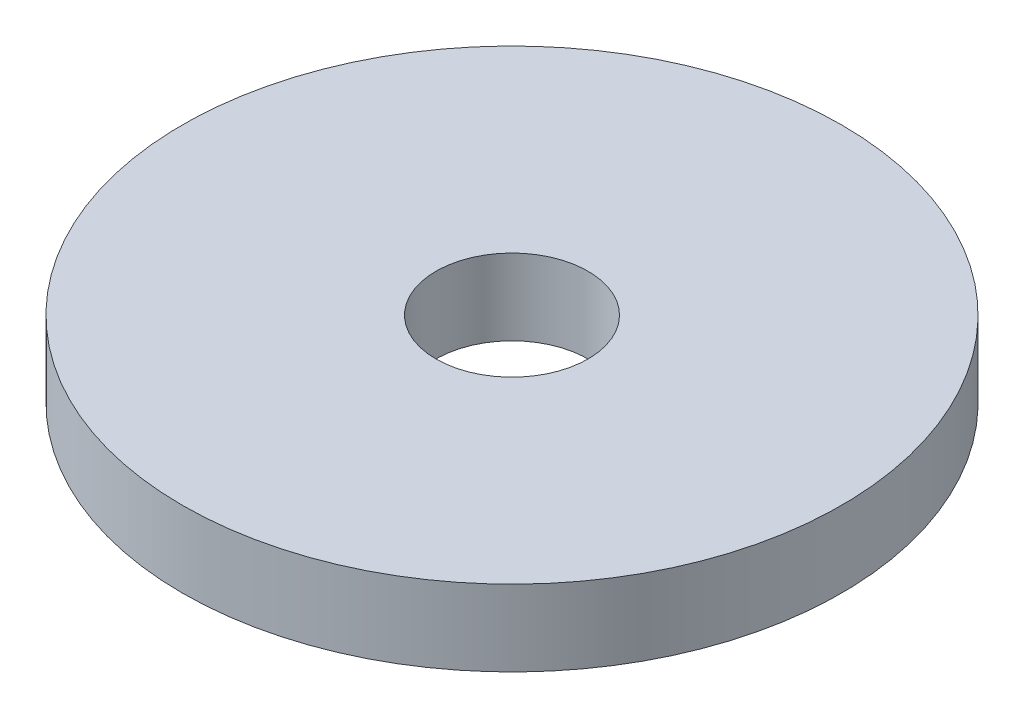
from build123d import *

# Parameters (mm, degrees)
SKETCH1_R           = 13
SKETCH1_R_2         = 3
BOSS_EXTRUDE1_DEPTH = 3


with BuildPart() as part:
    # Sketch1 → Boss-Extrude1 (new body)
    with BuildSketch(Plane(origin=(0, 0, 0), x_dir=(1, 0, 0), z_dir=(0, 1, 0))):
        with Locations(Location((0, 0, 0), (0, 0, 270))):
            Circle(SKETCH1_R)
        with Locations(Location((0, 0, 0), (0, 0, 270))):
            Circle(SKETCH1_R_2, mode=Mode.SUBTRACT)
    extrude(amount=BOSS_EXTRUDE1_DEPTH)


solid = part.part
